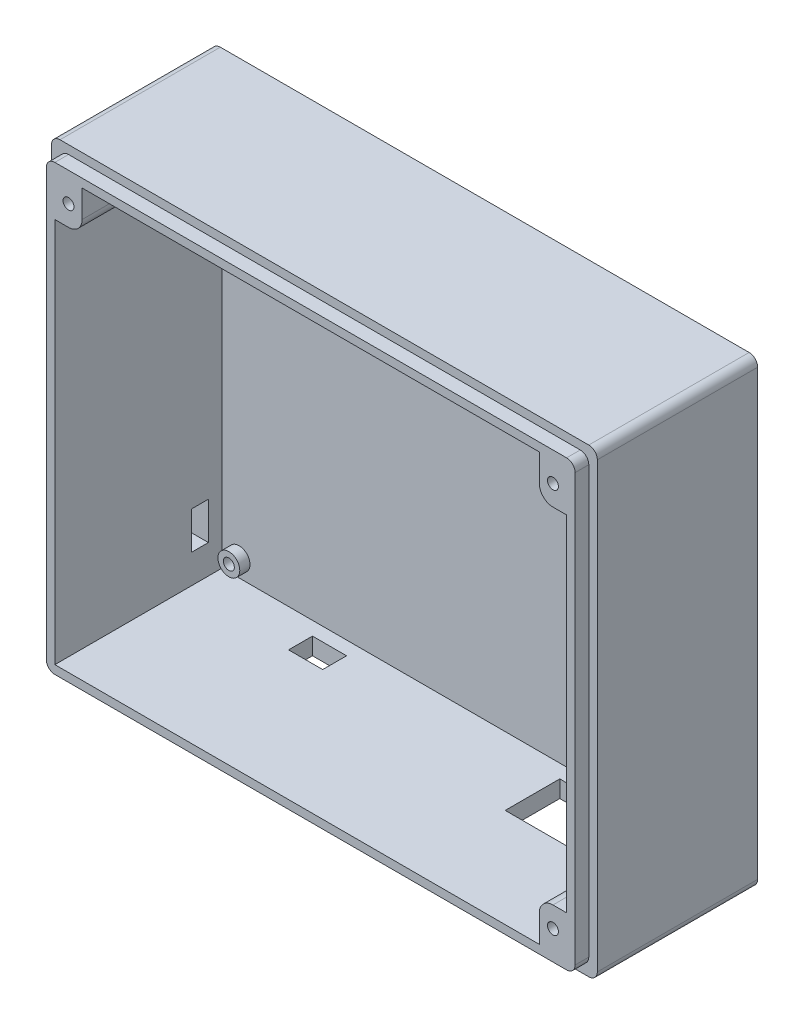
from build123d import *

# Parameters (mm, degrees)
ESQUISSE1_W             = 150
ESQUISSE1_H             = 125
BOSS_EXTRU_3_DEPTH      = 2
BOSS_EXTRU_4_DEPTH      = 51
BOSS_EXTRU_6_DEPTH      = 47
ESQUISSE1_9_R           = 3.2
ESQUISSE1_9_R_2         = 1.6
BOSS_EXTRU_7_DEPTH      = 5
ESQUISSE3_W             = 18
ESQUISSE3_H             = 16
ESQUISSE3_W_2           = 10
ESQUISSE3_H_2           = 7
ENL_V_MAT_EXTRU_1_DEPTH = 15
ESQUISSE4_W             = 5
ESQUISSE4_H             = 11
ENL_V_MAT_EXTRU_2_DEPTH = 15
ESQUISSE1_12_W          = 8
ESQUISSE1_12_H          = 12
ESQUISSE1_12_R          = 1.6
BOSS_EXTRU_8_DEPTH      = 51
CONG_5_R                = 4


with BuildPart() as part:
    # Esquisse1 → Boss.-Extru.3 (new body)
    with BuildSketch(Plane.XY):
        with Locations((80, 67.5)):
            Rectangle(ESQUISSE1_W, ESQUISSE1_H)
    extrude(amount=BOSS_EXTRU_3_DEPTH)

    # Esquisse1<6> → Boss.-Extru.4 (add)
    with BuildSketch(Plane.XY):
        with BuildLine():
            ThreePointArc((2.5, 5), (3.232233047, 3.232233047), (5, 2.5))
            Line((5, 2.5), (155, 2.5))
            ThreePointArc((155, 2.5), (156.767766953, 3.232233047), (157.5, 5))
            Line((157.5, 5), (157.5, 130))
            ThreePointArc((157.5, 130), (156.767766953, 131.767766953), (155, 132.5))
            Line((155, 132.5), (5, 132.5))
            ThreePointArc((5, 132.5), (3.232233047, 131.767766953), (2.5, 130))
            Line((2.5, 130), (2.5, 5))
        make_face()
        Polygon((147, 5), (5, 5), (5, 118), (5, 130), (13, 130), (147, 130), (155, 130), (155, 118), (155, 17), (155, 5), align=None, mode=Mode.SUBTRACT)
    extrude(amount=BOSS_EXTRU_4_DEPTH)

    # Esquisse1<8> → Boss.-Extru.6 (add)
    with BuildSketch(Plane.XY):
        with BuildLine():
            ThreePointArc((0, 2.5), (0.732233047, 0.732233047), (2.5, 0))
            Line((2.5, 0), (157.5, 0))
            ThreePointArc((157.5, 0), (159.267766953, 0.732233047), (160, 2.5))
            Line((160, 2.5), (160, 132.5))
            ThreePointArc((160, 132.5), (159.267766953, 134.267766953), (157.5, 135))
            Line((157.5, 135), (2.5, 135))
            ThreePointArc((2.5, 135), (0.732233047, 134.267766953), (0, 132.5))
            Line((0, 132.5), (0, 2.5))
        make_face()
        with BuildLine():
            Line((155, 2.5), (5, 2.5))
            ThreePointArc((5, 2.5), (3.232233047, 3.232233047), (2.5, 5))
            Line((2.5, 5), (2.5, 130))
            ThreePointArc((2.5, 130), (3.232233047, 131.767766953), (5, 132.5))
            Line((5, 132.5), (155, 132.5))
            ThreePointArc((155, 132.5), (156.767766953, 131.767766953), (157.5, 130))
            Line((157.5, 130), (157.5, 5))
            ThreePointArc((157.5, 5), (156.767766953, 3.232233047), (155, 2.5))
        make_face(mode=Mode.SUBTRACT)
    extrude(amount=BOSS_EXTRU_6_DEPTH)

    # Esquisse1<9> → Boss.-Extru.7 (add)
    # profile 1 of 4: a face of its own
    with BuildSketch(Plane.XY):
        with Locations((10, 10)):
            Circle(ESQUISSE1_9_R)
        with Locations((10, 10)):
            Circle(ESQUISSE1_9_R_2, mode=Mode.SUBTRACT)
    # profile 2 of 4: a face of its own
    with BuildSketch(Plane.XY):
        with Locations((142, 10)):
            Circle(ESQUISSE1_9_R)
        with Locations((142, 10)):
            Circle(ESQUISSE1_9_R_2, mode=Mode.SUBTRACT)
    # profile 3 of 4: a face of its own
    with BuildSketch(Plane.XY):
        with Locations((142, 112)):
            Circle(ESQUISSE1_9_R)
        with Locations((142, 112)):
            Circle(ESQUISSE1_9_R_2, mode=Mode.SUBTRACT)
    # profile 4 of 4: a face of its own
    with BuildSketch(Plane.XY):
        with Locations((10, 112)):
            Circle(ESQUISSE1_9_R)
        with Locations((10, 112)):
            Circle(ESQUISSE1_9_R_2, mode=Mode.SUBTRACT)
    extrude(amount=BOSS_EXTRU_7_DEPTH)

    # Esquisse3 → Enlèv. mat.-Extru.1 (cut)
    with BuildSketch(Plane.XZ):
        with Locations((117, 14)):
            Rectangle(ESQUISSE3_W, ESQUISSE3_H)
        with Locations((40.5, 9.5)):
            Rectangle(ESQUISSE3_W_2, ESQUISSE3_H_2)
    extrude(amount=-ENL_V_MAT_EXTRU_1_DEPTH, mode=Mode.SUBTRACT)

    # Esquisse4 → Enlèv. mat.-Extru.2 (cut)
    with BuildSketch(Plane.ZY):
        with Locations((8.5, 19)):
            Rectangle(ESQUISSE4_W, ESQUISSE4_H)
    extrude(amount=-ENL_V_MAT_EXTRU_2_DEPTH, mode=Mode.SUBTRACT)

    # Esquisse1<12> → Boss.-Extru.8 (add)
    # profile 1 of 3: a face of its own
    with BuildSketch(Plane.XY):
        with Locations((151, 11)):
            Rectangle(ESQUISSE1_12_W, ESQUISSE1_12_H)
        with Locations((151, 11)):
            Circle(ESQUISSE1_12_R, mode=Mode.SUBTRACT)
    # profile 2 of 3: a face of its own
    with BuildSketch(Plane.XY):
        with Locations((9, 124)):
            Rectangle(ESQUISSE1_12_W, ESQUISSE1_12_H)
        with Locations((9, 124)):
            Circle(ESQUISSE1_12_R, mode=Mode.SUBTRACT)
    # profile 3 of 3: a face of its own
    with BuildSketch(Plane.XY):
        with Locations((151, 124)):
            Rectangle(ESQUISSE1_12_W, ESQUISSE1_12_H)
        with Locations((151, 124)):
            Circle(ESQUISSE1_12_R, mode=Mode.SUBTRACT)
    extrude(amount=BOSS_EXTRU_8_DEPTH)

    # Congé5
    cong_5_edges = [part.edges().sort_by_distance(p)[0] for p in [
        (147, 17, 26.5),
        (147, 118, 26.5),
        (13, 118, 26.5),
    ]]
    fillet(cong_5_edges, radius=CONG_5_R)


solid = part.part
